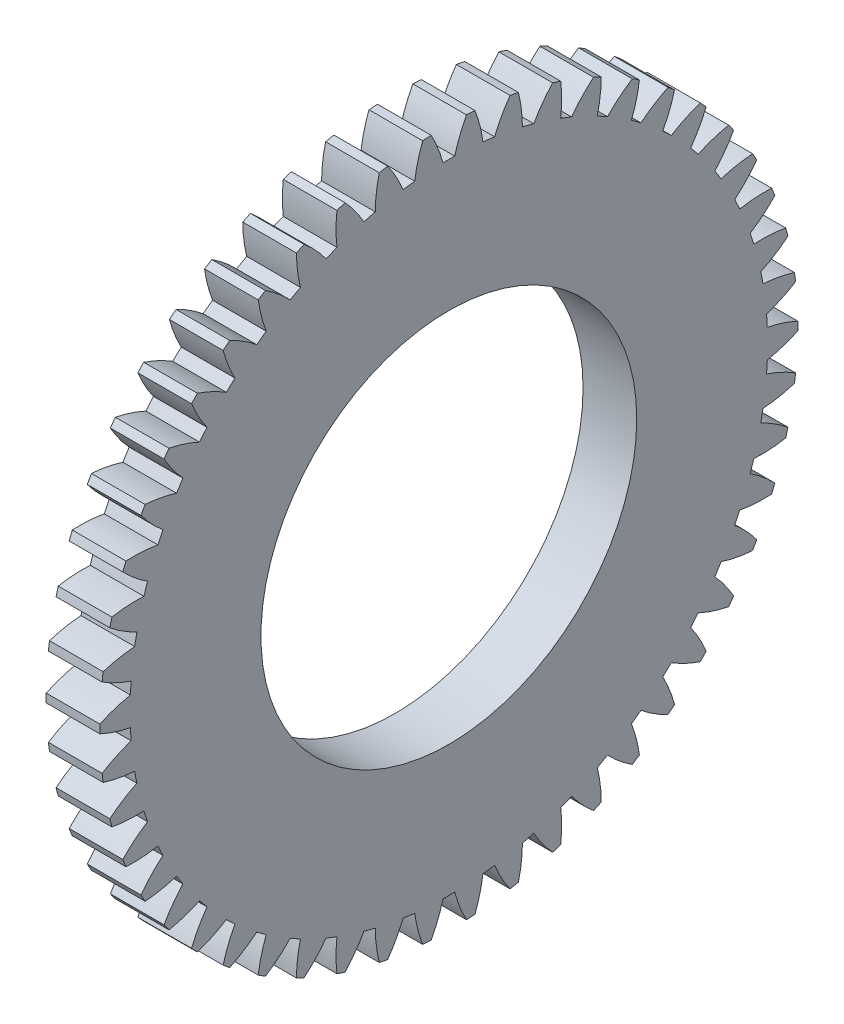
from build123d import *

# Parameters (mm, degrees)
SKETCH1_R           = 7.75
BOSS_EXTRUDE1_DEPTH = 2
SKETCH2_R           = 7.75
SKETCH2_R_2         = 7
BOSS_EXTRUDE2_DEPTH = 2


with BuildPart() as part:
    # Sketch1 → Boss-Extrude1 (new body)
    with BuildSketch(Plane(origin=(-24.328890261, 0, 0), x_dir=(0, 0, -1), z_dir=(1, 0, 0))):
        with BuildLine():
            ThreePointArc((-24.553557802, 1.242259575), (-24.541835716, 1.023863585), (-24.526093094, 0.805720545))
            ThreePointArc((-24.526093094, 0.805720545), (-25.082118183, 0.584044861), (-25.60766799, 0.297511427))
            ThreePointArc((-25.60766799, 0.297511427), (-25.588757459, 0.140106177), (-25.567928787, -0.017056755))
            ThreePointArc((-25.567928787, -0.017056755), (-24.987632127, -0.163889292), (-24.393947088, -0.24032281))
            ThreePointArc((-24.393947088, -0.24032281), (-24.354945157, -0.455527516), (-24.311986099, -0.669977359))
            ThreePointArc((-24.311986099, -0.669977359), (-24.835843434, -0.959593486), (-25.321336962, -1.309736375))
            ThreePointArc((-25.321336962, -1.309736375), (-25.282847437, -1.46353032), (-25.242485267, -1.61684345))
            ThreePointArc((-25.242485267, -1.61684345), (-24.648361422, -1.689787712), (-24.049778107, -1.691210063))
            ThreePointArc((-24.049778107, -1.691210063), (-23.984111417, -1.899829578), (-23.914613411, -2.107204222))
            ThreePointArc((-23.914613411, -2.107204222), (-24.398041448, -2.460193374), (-24.835822174, -2.868423755))
            ThreePointArc((-24.835822174, -2.868423755), (-24.778360659, -3.016180971), (-24.719101526, -3.163226461))
            ThreePointArc((-24.719101526, -3.163226461), (-24.120520185, -3.161132073), (-23.52647861, -3.087520826))
            ThreePointArc((-23.52647861, -3.087520826), (-23.435182763, -3.286265094), (-23.340241835, -3.483294118))
            ThreePointArc((-23.340241835, -3.483294118), (-23.775616626, -3.894089444), (-24.158780487, -4.353969281))
            ThreePointArc((-24.158780487, -4.353969281), (-24.083253183, -4.49335955), (-24.006031639, -4.631818403))
            ThreePointArc((-24.006031639, -4.631818403), (-23.412432787, -4.554718394), (-22.832301343, -4.407234443))
            ThreePointArc((-22.832301343, -4.407234443), (-22.71681613, -4.59296915), (-22.597929555, -4.776545287))
            ThreePointArc((-22.597929555, -4.776545287), (-22.978384979, -5.2386683), (-23.300889251, -5.742945012))
            ThreePointArc((-23.300889251, -5.742945012), (-23.208487269, -5.871770066), (-23.114521145, -5.999458704))
            ThreePointArc((-23.114521145, -5.999458704), (-22.53526619, -5.848568989), (-21.978193897, -5.629538243))
            ThreePointArc((-21.978193897, -5.629538243), (-21.840340587, -5.799334241), (-21.699383277, -5.966562387))
            ThreePointArc((-21.699383277, -5.966562387), (-22.018919325, -6.472725129), (-22.275677924, -7.013445973))
            ThreePointArc((-22.275677924, -7.013445973), (-22.167858499, -7.129674163), (-22.058629695, -7.24457886))
            ThreePointArc((-22.058629695, -7.24457886), (-21.502853835, -7.022279059), (-20.977626055, -6.735155764))
            ThreePointArc((-20.977626055, -6.735155764), (-20.819578678, -6.886335268), (-20.658773614, -7.034578135))
            ThreePointArc((-20.658773614, -7.034578135), (-20.912351012, -7.57679812), (-21.099314701, -8.145435603))
            ThreePointArc((-21.099314701, -8.145435603), (-20.977778209, -8.247233942), (-20.85500933, -8.347542582))
            ThreePointArc((-20.85500933, -8.347542582), (-20.331477482, -8.057338496), (-19.84637737, -7.706650757))
            ThreePointArc((-19.84637737, -7.706650757), (-19.670628428, -7.836829578), (-19.492511602, -7.963749286))
            ThreePointArc((-19.492511602, -7.963749286), (-19.676131283, -8.53347538), (-19.790351532, -9.12106175))
            ThreePointArc((-19.790351532, -9.12106175), (-19.657014677, -9.206824818), (-19.522641861, -9.290955474))
            ThreePointArc((-19.522641861, -9.290955474), (-19.039610434, -8.937423793), (-18.60228831, -8.528702167))
            ThreePointArc((-18.60228831, -8.528702167), (-18.411609468, -8.635827305), (-18.21898989, -8.739422256))
            ThreePointArc((-18.21898989, -8.739422256), (-18.329756061, -9.327669538), (-18.36943155, -9.924938207))
            ThreePointArc((-18.36943155, -9.924938207), (-18.226397133, -9.993313468), (-18.08253952, -10.059939349))
            ThreePointArc((-18.08253952, -10.059939349), (-17.647626208, -9.648655481), (-17.264978903, -9.188345751))
            ThreePointArc((-17.264978903, -9.188345751), (-17.062377281, -9.27072778), (-16.858292675, -9.349364219))
            ThreePointArc((-16.858292675, -9.349364219), (-16.894458487, -9.946855677), (-16.85896351, -10.544387363))
            ThreePointArc((-16.85896351, -10.544387363), (-16.708487269, -10.594296498), (-16.557413579, -10.642366874))
            ThreePointArc((-16.557413579, -10.642366874), (-16.177477227, -10.179817011), (-15.855539316, -9.675178536))
            ThreePointArc((-15.855539316, -9.675178536), (-15.644210062, -9.731518242), (-15.431878965, -9.783956026))
            ThreePointArc((-15.431878965, -9.783956026), (-15.392874063, -10.381268863), (-15.282768396, -10.969640132))
            ThreePointArc((-15.282768396, -10.969640132), (-15.127223432, -11.000296046), (-14.971316187, -11.029052819))
            ThreePointArc((-14.971316187, -11.029052819), (-14.652348617, -10.522531647), (-14.396197255, -9.981522878))
            ThreePointArc((-14.396197255, -9.981522878), (-14.179473158, -10.01093175), (-13.962244158, -10.036343903))
            ThreePointArc((-13.962244158, -10.036343903), (-13.848683671, -10.62405814), (-13.665703746, -11.193990027))
            ThreePointArc((-13.665703746, -11.193990027), (-13.507543096, -11.204909256), (-13.349261048, -11.213898914))
            ThreePointArc((-13.349261048, -11.213898914), (-13.096292567, -10.671394576), (-12.909967414, -10.102547545))
            ThreePointArc((-12.909967414, -10.102547545), (-12.691266342, -10.104561786), (-12.47256527, -10.102547545))
            ThreePointArc((-12.47256527, -10.102547545), (-12.286240117, -10.671394576), (-12.033271637, -11.213898914))
            ThreePointArc((-12.033271637, -11.213898914), (-11.874989588, -11.204909256), (-11.716828938, -11.193990027))
            ThreePointArc((-11.716828938, -11.193990027), (-11.533849013, -10.62405814), (-11.420288527, -10.036343903))
            ThreePointArc((-11.420288527, -10.036343903), (-11.203059527, -10.01093175), (-10.98633543, -9.981522878))
            ThreePointArc((-10.98633543, -9.981522878), (-10.730184068, -10.522531647), (-10.411216497, -11.029052819))
            ThreePointArc((-10.411216497, -11.029052819), (-10.255309253, -11.000296046), (-10.099764289, -10.969640132))
            ThreePointArc((-10.099764289, -10.969640132), (-9.989658621, -10.381268863), (-9.950653719, -9.783956026))
            ThreePointArc((-9.950653719, -9.783956026), (-9.738322622, -9.731518242), (-9.526993368, -9.675178536))
            ThreePointArc((-9.526993368, -9.675178536), (-9.205055458, -10.179817011), (-8.825119105, -10.642366874))
            ThreePointArc((-8.825119105, -10.642366874), (-8.674045415, -10.594296498), (-8.523569175, -10.544387363))
            ThreePointArc((-8.523569175, -10.544387363), (-8.488074197, -9.946855677), (-8.524240009, -9.349364219))
            ThreePointArc((-8.524240009, -9.349364219), (-8.320155404, -9.27072778), (-8.117553782, -9.188345751))
            ThreePointArc((-8.117553782, -9.188345751), (-7.734906476, -9.648655481), (-7.299993165, -10.059939349))
            ThreePointArc((-7.299993165, -10.059939349), (-7.156135552, -9.993313468), (-7.013101135, -9.924938207))
            ThreePointArc((-7.013101135, -9.924938207), (-7.052776624, -9.327669538), (-7.163542794, -8.739422256))
            ThreePointArc((-7.163542794, -8.739422256), (-6.970923216, -8.635827305), (-6.780244374, -8.528702167))
            ThreePointArc((-6.780244374, -8.528702167), (-6.34292225, -8.937423793), (-5.859890823, -9.290955474))
            ThreePointArc((-5.859890823, -9.290955474), (-5.725518007, -9.206824818), (-5.592181152, -9.12106175))
            ThreePointArc((-5.592181152, -9.12106175), (-5.706401402, -8.53347538), (-5.890021082, -7.963749286))
            ThreePointArc((-5.890021082, -7.963749286), (-5.711904256, -7.836829578), (-5.536155314, -7.706650757))
            ThreePointArc((-5.536155314, -7.706650757), (-5.051055203, -8.057338496), (-4.527523354, -8.347542582))
            ThreePointArc((-4.527523354, -8.347542582), (-4.404754475, -8.247233942), (-4.283217983, -8.145435603))
            ThreePointArc((-4.283217983, -8.145435603), (-4.470181672, -7.57679812), (-4.72375907, -7.034578135))
            ThreePointArc((-4.72375907, -7.034578135), (-4.562954006, -6.886335268), (-4.40490663, -6.735155764))
            ThreePointArc((-4.40490663, -6.735155764), (-3.879678849, -7.022279059), (-3.323902989, -7.24457886))
            ThreePointArc((-3.323902989, -7.24457886), (-3.214674186, -7.129674163), (-3.10685476, -7.013445973))
            ThreePointArc((-3.10685476, -7.013445973), (-3.363613359, -6.472725129), (-3.683149407, -5.966562387))
            ThreePointArc((-3.683149407, -5.966562387), (-3.542192097, -5.799334241), (-3.404338788, -5.629538243))
            ThreePointArc((-3.404338788, -5.629538243), (-2.847266494, -5.848568989), (-2.26801154, -5.999458704))
            ThreePointArc((-2.26801154, -5.999458704), (-2.174045415, -5.871770066), (-2.081643433, -5.742945012))
            ThreePointArc((-2.081643433, -5.742945012), (-2.404147705, -5.2386683), (-2.78460313, -4.776545287))
            ThreePointArc((-2.78460313, -4.776545287), (-2.665716555, -4.59296915), (-2.550231341, -4.407234443))
            ThreePointArc((-2.550231341, -4.407234443), (-1.970099897, -4.554718394), (-1.376501045, -4.631818403))
            ThreePointArc((-1.376501045, -4.631818403), (-1.299279502, -4.49335955), (-1.223752197, -4.353969281))
            ThreePointArc((-1.223752197, -4.353969281), (-1.606916058, -3.894089444), (-2.042290849, -3.483294118))
            ThreePointArc((-2.042290849, -3.483294118), (-1.947349921, -3.286265094), (-1.856054074, -3.087520826))
            ThreePointArc((-1.856054074, -3.087520826), (-1.262012499, -3.161132073), (-0.663431158, -3.163226461))
            ThreePointArc((-0.663431158, -3.163226461), (-0.604172026, -3.016180971), (-0.54671051, -2.868423755))
            ThreePointArc((-0.54671051, -2.868423755), (-0.984491236, -2.460193374), (-1.467919273, -2.107204222))
            ThreePointArc((-1.467919273, -2.107204222), (-1.398421268, -1.899829578), (-1.332754578, -1.691210063))
            ThreePointArc((-1.332754578, -1.691210063), (-0.734171262, -1.689787712), (-0.140047418, -1.61684345))
            ThreePointArc((-0.140047418, -1.61684345), (-0.099685247, -1.46353032), (-0.061195723, -1.309736375))
            ThreePointArc((-0.061195723, -1.309736375), (-0.546689251, -0.959593486), (-1.070546585, -0.669977359))
            ThreePointArc((-1.070546585, -0.669977359), (-1.027587527, -0.455527516), (-0.988585597, -0.24032281))
            ThreePointArc((-0.988585597, -0.24032281), (-0.394900558, -0.163889292), (0.185396103, -0.017056755))
            ThreePointArc((0.185396103, -0.017056755), (0.206224775, 0.140106177), (0.225135306, 0.297511427))
            ThreePointArc((0.225135306, 0.297511427), (-0.300414501, 0.584044861), (-0.85643959, 0.805720545))
            ThreePointArc((-0.85643959, 0.805720545), (-0.840696969, 1.023863585), (-0.828974882, 1.242259575))
            ThreePointArc((-0.828974882, 1.242259575), (-0.249550887, 1.392498858), (0.307766965, 1.610904033))
            ThreePointArc((0.307766965, 1.610904033), (0.308733658, 1.769438214), (0.307766965, 1.927972394))
            ThreePointArc((0.307766965, 1.927972394), (-0.249550887, 2.146377569), (-0.828974882, 2.296616852))
            ThreePointArc((-0.828974882, 2.296616852), (-0.840696969, 2.515012842), (-0.85643959, 2.733155882))
            ThreePointArc((-0.85643959, 2.733155882), (-0.300414501, 2.954831566), (0.225135306, 3.241365))
            ThreePointArc((0.225135306, 3.241365), (0.206224775, 3.39877025), (0.185396103, 3.555933182))
            ThreePointArc((0.185396103, 3.555933182), (-0.394900558, 3.702765719), (-0.988585597, 3.779199237))
            ThreePointArc((-0.988585597, 3.779199237), (-1.027587527, 3.994403943), (-1.070546585, 4.208853786))
            ThreePointArc((-1.070546585, 4.208853786), (-0.546689251, 4.498469914), (-0.061195723, 4.848612802))
            ThreePointArc((-0.061195723, 4.848612802), (-0.099685247, 5.002406747), (-0.140047418, 5.155719877))
            ThreePointArc((-0.140047418, 5.155719877), (-0.734171262, 5.228664139), (-1.332754578, 5.23008649))
            ThreePointArc((-1.332754578, 5.23008649), (-1.398421268, 5.438706005), (-1.467919273, 5.646080649))
            ThreePointArc((-1.467919273, 5.646080649), (-0.984491236, 5.999069801), (-0.54671051, 6.407300182))
            ThreePointArc((-0.54671051, 6.407300182), (-0.604172026, 6.555057398), (-0.663431158, 6.702102888))
            ThreePointArc((-0.663431158, 6.702102888), (-1.262012499, 6.7000085), (-1.856054074, 6.626397253))
            ThreePointArc((-1.856054074, 6.626397253), (-1.947349921, 6.825141522), (-2.042290849, 7.022170545))
            ThreePointArc((-2.042290849, 7.022170545), (-1.606916058, 7.432965871), (-1.223752197, 7.892845708))
            ThreePointArc((-1.223752197, 7.892845708), (-1.299279502, 8.032235977), (-1.376501045, 8.17069483))
            ThreePointArc((-1.376501045, 8.17069483), (-1.970099897, 8.093594822), (-2.550231341, 7.94611087))
            ThreePointArc((-2.550231341, 7.94611087), (-2.665716555, 8.131845577), (-2.78460313, 8.315421715))
            ThreePointArc((-2.78460313, 8.315421715), (-2.404147705, 8.777544727), (-2.081643433, 9.281821439))
            ThreePointArc((-2.081643433, 9.281821439), (-2.174045415, 9.410646493), (-2.26801154, 9.538335131))
            ThreePointArc((-2.26801154, 9.538335131), (-2.847266494, 9.387445416), (-3.404338788, 9.16841467))
            ThreePointArc((-3.404338788, 9.16841467), (-3.542192097, 9.338210668), (-3.683149407, 9.505438814))
            ThreePointArc((-3.683149407, 9.505438814), (-3.363613359, 10.011601557), (-3.10685476, 10.5523224))
            ThreePointArc((-3.10685476, 10.5523224), (-3.214674186, 10.668550591), (-3.323902989, 10.783455288))
            ThreePointArc((-3.323902989, 10.783455288), (-3.879678849, 10.561155486), (-4.40490663, 10.274032191))
            ThreePointArc((-4.40490663, 10.274032191), (-4.562954006, 10.425211696), (-4.72375907, 10.573454562))
            ThreePointArc((-4.72375907, 10.573454562), (-4.470181672, 11.115674547), (-4.283217983, 11.68431203))
            ThreePointArc((-4.283217983, 11.68431203), (-4.404754475, 11.78611037), (-4.527523354, 11.88641901))
            ThreePointArc((-4.527523354, 11.88641901), (-5.051055203, 11.596214923), (-5.536155314, 11.245527184))
            ThreePointArc((-5.536155314, 11.245527184), (-5.711904256, 11.375706005), (-5.890021082, 11.502625714))
            ThreePointArc((-5.890021082, 11.502625714), (-5.706401402, 12.072351807), (-5.592181152, 12.659938177))
            ThreePointArc((-5.592181152, 12.659938177), (-5.725518007, 12.745701245), (-5.859890823, 12.829831901))
            ThreePointArc((-5.859890823, 12.829831901), (-6.34292225, 12.47630022), (-6.780244374, 12.067578594))
            ThreePointArc((-6.780244374, 12.067578594), (-6.970923216, 12.174703732), (-7.163542794, 12.278298684))
            ThreePointArc((-7.163542794, 12.278298684), (-7.052776624, 12.866545965), (-7.013101135, 13.463814635))
            ThreePointArc((-7.013101135, 13.463814635), (-7.156135552, 13.532189896), (-7.299993165, 13.598815777))
            ThreePointArc((-7.299993165, 13.598815777), (-7.734906476, 13.187531908), (-8.117553782, 12.727222178))
            ThreePointArc((-8.117553782, 12.727222178), (-8.320155404, 12.809604207), (-8.524240009, 12.888240647))
            ThreePointArc((-8.524240009, 12.888240647), (-8.488074197, 13.485732104), (-8.523569175, 14.08326379))
            ThreePointArc((-8.523569175, 14.08326379), (-8.674045415, 14.133172925), (-8.825119105, 14.181243302))
            ThreePointArc((-8.825119105, 14.181243302), (-9.205055458, 13.718693438), (-9.526993368, 13.214054963))
            ThreePointArc((-9.526993368, 13.214054963), (-9.738322622, 13.270394669), (-9.950653719, 13.322832453))
            ThreePointArc((-9.950653719, 13.322832453), (-9.989658621, 13.920145291), (-10.099764289, 14.50851656))
            ThreePointArc((-10.099764289, 14.50851656), (-10.255309253, 14.539172473), (-10.411216497, 14.567929246))
            ThreePointArc((-10.411216497, 14.567929246), (-10.730184068, 14.061408074), (-10.98633543, 13.520399306))
            ThreePointArc((-10.98633543, 13.520399306), (-11.203059527, 13.549808177), (-11.420288527, 13.575220331))
            ThreePointArc((-11.420288527, 13.575220331), (-11.533849013, 14.162934567), (-11.716828938, 14.732866454))
            ThreePointArc((-11.716828938, 14.732866454), (-11.874989588, 14.743785683), (-12.033271637, 14.752775341))
            ThreePointArc((-12.033271637, 14.752775341), (-12.286240117, 14.210271003), (-12.47256527, 13.641423972))
            ThreePointArc((-12.47256527, 13.641423972), (-12.691266342, 13.643438214), (-12.909967414, 13.641423972))
            ThreePointArc((-12.909967414, 13.641423972), (-13.096292567, 14.210271003), (-13.349261048, 14.752775341))
            ThreePointArc((-13.349261048, 14.752775341), (-13.507543096, 14.743785683), (-13.665703746, 14.732866454))
            ThreePointArc((-13.665703746, 14.732866454), (-13.848683671, 14.162934567), (-13.962244158, 13.575220331))
            ThreePointArc((-13.962244158, 13.575220331), (-14.179473158, 13.549808177), (-14.396197255, 13.520399306))
            ThreePointArc((-14.396197255, 13.520399306), (-14.652348617, 14.061408074), (-14.971316187, 14.567929246))
            ThreePointArc((-14.971316187, 14.567929246), (-15.127223432, 14.539172473), (-15.282768396, 14.50851656))
            ThreePointArc((-15.282768396, 14.50851656), (-15.392874063, 13.920145291), (-15.431878965, 13.322832453))
            ThreePointArc((-15.431878965, 13.322832453), (-15.644210062, 13.270394669), (-15.855539316, 13.214054963))
            ThreePointArc((-15.855539316, 13.214054963), (-16.177477227, 13.718693438), (-16.557413579, 14.181243302))
            ThreePointArc((-16.557413579, 14.181243302), (-16.708487269, 14.133172925), (-16.85896351, 14.08326379))
            ThreePointArc((-16.85896351, 14.08326379), (-16.894458487, 13.485732104), (-16.858292675, 12.888240647))
            ThreePointArc((-16.858292675, 12.888240647), (-17.062377281, 12.809604207), (-17.264978903, 12.727222178))
            ThreePointArc((-17.264978903, 12.727222178), (-17.647626208, 13.187531908), (-18.08253952, 13.598815777))
            ThreePointArc((-18.08253952, 13.598815777), (-18.226397133, 13.532189896), (-18.36943155, 13.463814635))
            ThreePointArc((-18.36943155, 13.463814635), (-18.329756061, 12.866545965), (-18.21898989, 12.278298684))
            ThreePointArc((-18.21898989, 12.278298684), (-18.411609468, 12.174703732), (-18.60228831, 12.067578594))
            ThreePointArc((-18.60228831, 12.067578594), (-19.039610434, 12.47630022), (-19.522641861, 12.829831901))
            ThreePointArc((-19.522641861, 12.829831901), (-19.657014677, 12.745701245), (-19.790351532, 12.659938177))
            ThreePointArc((-19.790351532, 12.659938177), (-19.676131283, 12.072351807), (-19.492511602, 11.502625714))
            ThreePointArc((-19.492511602, 11.502625714), (-19.670628428, 11.375706005), (-19.84637737, 11.245527184))
            ThreePointArc((-19.84637737, 11.245527184), (-20.331477482, 11.596214923), (-20.85500933, 11.88641901))
            ThreePointArc((-20.85500933, 11.88641901), (-20.977778209, 11.78611037), (-21.099314701, 11.68431203))
            ThreePointArc((-21.099314701, 11.68431203), (-20.912351012, 11.115674547), (-20.658773614, 10.573454562))
            ThreePointArc((-20.658773614, 10.573454562), (-20.819578678, 10.425211696), (-20.977626055, 10.274032191))
            ThreePointArc((-20.977626055, 10.274032191), (-21.502853835, 10.561155486), (-22.058629695, 10.783455288))
            ThreePointArc((-22.058629695, 10.783455288), (-22.167858499, 10.668550591), (-22.275677924, 10.5523224))
            ThreePointArc((-22.275677924, 10.5523224), (-22.018919325, 10.011601557), (-21.699383277, 9.505438814))
            ThreePointArc((-21.699383277, 9.505438814), (-21.840340587, 9.338210668), (-21.978193897, 9.16841467))
            ThreePointArc((-21.978193897, 9.16841467), (-22.53526619, 9.387445416), (-23.114521145, 9.538335131))
            ThreePointArc((-23.114521145, 9.538335131), (-23.208487269, 9.410646493), (-23.300889251, 9.281821439))
            ThreePointArc((-23.300889251, 9.281821439), (-22.978384979, 8.777544727), (-22.597929555, 8.315421715))
            ThreePointArc((-22.597929555, 8.315421715), (-22.71681613, 8.131845577), (-22.832301343, 7.94611087))
            ThreePointArc((-22.832301343, 7.94611087), (-23.412432787, 8.093594822), (-24.006031639, 8.17069483))
            ThreePointArc((-24.006031639, 8.17069483), (-24.083253183, 8.032235977), (-24.158780487, 7.892845708))
            ThreePointArc((-24.158780487, 7.892845708), (-23.775616626, 7.432965871), (-23.340241835, 7.022170545))
            ThreePointArc((-23.340241835, 7.022170545), (-23.435182763, 6.825141522), (-23.52647861, 6.626397253))
            ThreePointArc((-23.52647861, 6.626397253), (-24.120520185, 6.7000085), (-24.719101526, 6.702102888))
            ThreePointArc((-24.719101526, 6.702102888), (-24.778360659, 6.555057398), (-24.835822174, 6.407300182))
            ThreePointArc((-24.835822174, 6.407300182), (-24.398041448, 5.999069801), (-23.914613411, 5.646080649))
            ThreePointArc((-23.914613411, 5.646080649), (-23.984111417, 5.438706005), (-24.049778107, 5.23008649))
            ThreePointArc((-24.049778107, 5.23008649), (-24.648361422, 5.228664139), (-25.242485267, 5.155719877))
            ThreePointArc((-25.242485267, 5.155719877), (-25.282847437, 5.002406747), (-25.321336962, 4.848612802))
            ThreePointArc((-25.321336962, 4.848612802), (-24.835843434, 4.498469914), (-24.311986099, 4.208853786))
            ThreePointArc((-24.311986099, 4.208853786), (-24.354945157, 3.994403943), (-24.393947088, 3.779199237))
            ThreePointArc((-24.393947088, 3.779199237), (-24.987632127, 3.702765719), (-25.567928787, 3.555933182))
            ThreePointArc((-25.567928787, 3.555933182), (-25.588757459, 3.39877025), (-25.60766799, 3.241365))
            ThreePointArc((-25.60766799, 3.241365), (-25.082118183, 2.954831566), (-24.526093094, 2.733155882))
            ThreePointArc((-24.526093094, 2.733155882), (-24.541835716, 2.515012842), (-24.553557802, 2.296616852))
            ThreePointArc((-24.553557802, 2.296616852), (-25.132981797, 2.146377569), (-25.690299649, 1.927972394))
            ThreePointArc((-25.690299649, 1.927972394), (-25.691266342, 1.769438214), (-25.690299649, 1.610904033))
            ThreePointArc((-25.690299649, 1.610904033), (-25.132981797, 1.392498858), (-24.553557802, 1.242259575))
        make_face()
        with Locations(Location((-12.691266342, 1.769438214, 0), (0, 0, 180))):
            Circle(SKETCH1_R, mode=Mode.SUBTRACT)
    extrude(amount=-BOSS_EXTRUDE1_DEPTH)

    # Sketch2 → Boss-Extrude2 (add)
    with BuildSketch(Plane(origin=(-24.328890261, 0, 0), x_dir=(0, 0, -1), z_dir=(1, 0, 0))):
        with Locations((-12.691266342, 1.769438214)):
            Circle(SKETCH2_R)
        with Locations((-12.691266342, 1.769438214)):
            Circle(SKETCH2_R_2, mode=Mode.SUBTRACT)
    extrude(amount=-BOSS_EXTRUDE2_DEPTH)


solid = part.part
